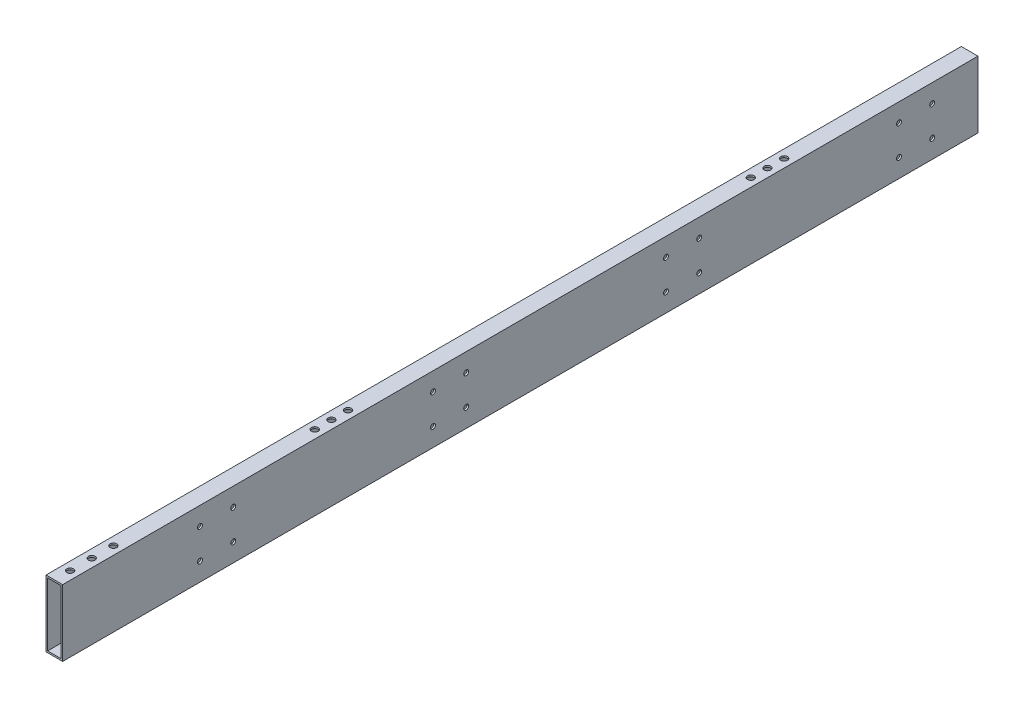
from build123d import *

# Parameters (mm, degrees)
SKETCH_1_W         = 10
SKETCH_1_H         = 40
SKETCH_1_W_2       = 8
SKETCH_1_H_2       = 38
EXTRUDE_1_DEPTH    = 550
SKETCH1_R          = 1.5
CUT_EXTRUDE1_DEPTH = 10
LPATTERN1_COUNT    = 4
LPATTERN1_PITCH    = 140
SKETCH2_R          = 2
CUT_EXTRUDE2_DEPTH = 40
SKETCH3_R          = 2
CUT_EXTRUDE3_DEPTH = 40


with BuildPart() as part:
    # 草图1 → 凸台-拉伸1 (new body)
    with BuildSketch(Plane.XY):
        Rectangle(SKETCH_1_W, SKETCH_1_H)
        Rectangle(SKETCH_1_W_2, SKETCH_1_H_2, mode=Mode.SUBTRACT)
    extrude(amount=EXTRUDE_1_DEPTH)

    # Sketch1 → Cut-Extrude1 (cut)
    with BuildSketch(Plane(origin=(5, 0, 0), x_dir=(0, 0, -1), z_dir=(1, 0, 0))):
        with Locations((-27.5, 9)):
            Circle(SKETCH1_R)
        with Locations((-47.5, 9)):
            Circle(SKETCH1_R)
        with Locations((-27.5, -9)):
            Circle(SKETCH1_R)
        with Locations((-47.5, -9)):
            Circle(SKETCH1_R)
    cut_extrude1 = extrude(amount=-CUT_EXTRUDE1_DEPTH, mode=Mode.SUBTRACT)

    # LPattern1: Cut-Extrude1 ×4
    with Locations(*[(0, 0, i * LPATTERN1_PITCH) for i in range(1, LPATTERN1_COUNT)]):
        add(cut_extrude1, mode=Mode.SUBTRACT)

    # Sketch2 → Cut-Extrude2 (cut)
    with BuildSketch(Plane(origin=(0, 20, 0), x_dir=(1, 0, 0), z_dir=(0, 1, 0))):
        with Locations(Location((0, -111.5, 0), (0, 0, 270))):
            Circle(SKETCH2_R)
        with Locations(Location((0, -121.5, 0), (0, 0, 270))):
            Circle(SKETCH2_R)
        with Locations(Location((0, -131.5, 0), (0, 0, 270))):
            Circle(SKETCH2_R)
        with Locations(Location((0, -373.5, 0), (0, 0, 270))):
            Circle(SKETCH2_R)
        with Locations(Location((0, -383.5, 0), (0, 0, 270))):
            Circle(SKETCH2_R)
        with Locations(Location((0, -393.5, 0), (0, 0, 270))):
            Circle(SKETCH2_R)
    extrude(amount=-CUT_EXTRUDE2_DEPTH, mode=Mode.SUBTRACT)

    # Sketch3 → Cut-Extrude3 (cut)
    with BuildSketch(Plane(origin=(0, 20, 0), x_dir=(1, 0, 0), z_dir=(0, 1, 0))):
        with Locations(Location((0, -540.5, 0), (0, 0, 270))):
            Circle(SKETCH3_R)
        with Locations(Location((0, -527.5, 0), (0, 0, 270))):
            Circle(SKETCH3_R)
        with Locations(Location((0, -514.5, 0), (0, 0, 270))):
            Circle(SKETCH3_R)
    extrude(amount=-CUT_EXTRUDE3_DEPTH, mode=Mode.SUBTRACT)


solid = part.part
